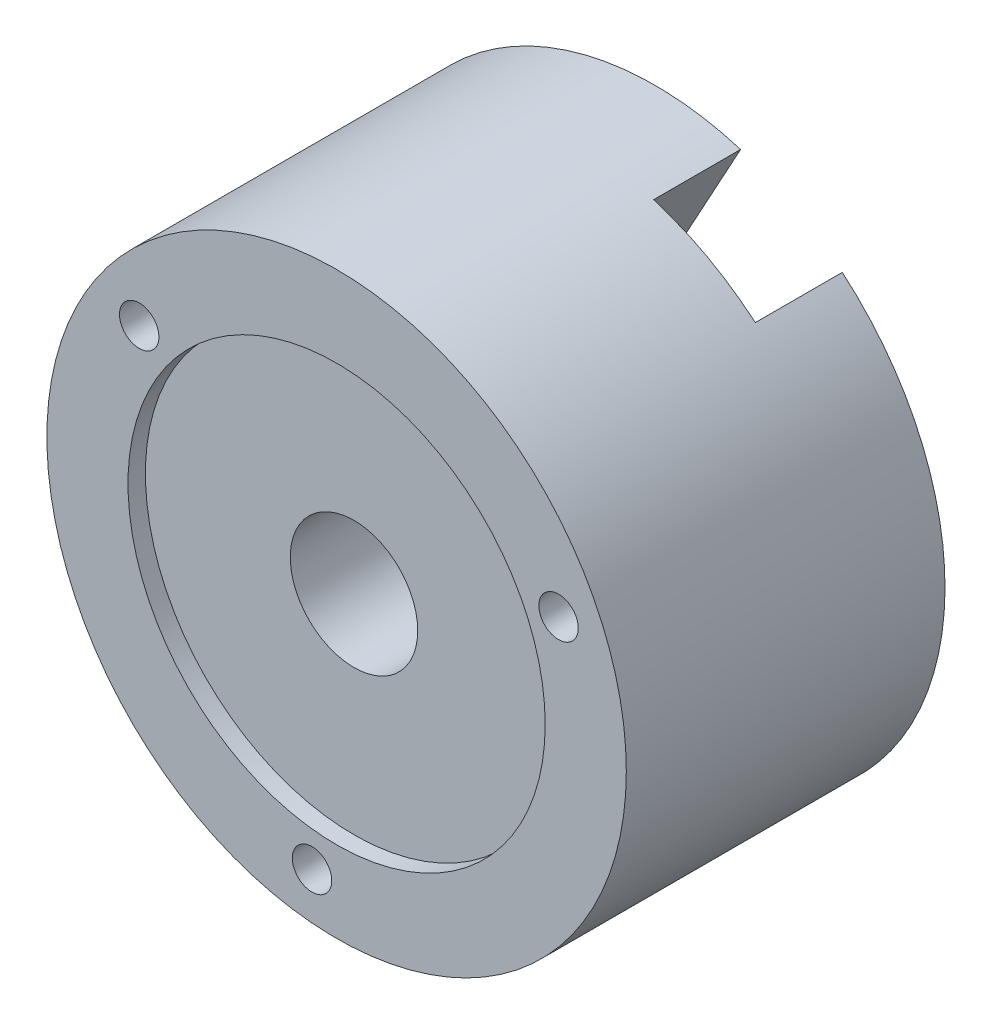
from build123d import *

# Parameters (mm, degrees)
SKETCH1_R                  = 50
BOSS_EXTRUDE1_DEPTH        = 55
SKETCH2_R                  = 36
CUT_EXTRUDE1_DEPTH         = 3
CUT_EXTRUDE2_REACH         = 89.772
SKETCH3_R                  = 11
M8X1_25_TAPPED_HOLE1_D     = 6.8
M8X1_25_TAPPED_HOLE1_DEPTH = 10.25
M8X1_25_TAPPED_HOLE1_TIP   = 2.042926105
CUT_EXTRUDE3_DEPTH         = 15


with BuildPart() as part:
    # Sketch1 → Boss-Extrude1 (new body)
    with BuildSketch(Plane.XY):
        Circle(SKETCH1_R)
    extrude(amount=BOSS_EXTRUDE1_DEPTH)

    # Sketch2 → Cut-Extrude1 (cut)
    with BuildSketch(Plane.XY.offset(55)):
        Circle(SKETCH2_R)
    extrude(amount=-CUT_EXTRUDE1_DEPTH, mode=Mode.SUBTRACT)

    # Sketch3 → Cut-Extrude2 (cut, up to next)
    with BuildSketch(Plane.XY.offset(52), mode=Mode.PRIVATE) as cut_extrude2_sk1:
        Circle(SKETCH3_R)
    cut_extrude2_tool1 = extrude(cut_extrude2_sk1.sketch, amount=-CUT_EXTRUDE2_REACH, mode=Mode.PRIVATE) & part.part
    add(cut_extrude2_tool1.solids().sort_by_distance((0, 0, 52))[0], mode=Mode.SUBTRACT)

    # M8x1.25 Tapped Hole1
    with Locations(Plane.XY.offset(55)):
        with Locations((-34.068677595, 24.562679147), (38.306242924, 17.223000697), (-4.237565329, -41.785679845), (0, 0)):
            Hole(M8X1_25_TAPPED_HOLE1_D / 2, depth=M8X1_25_TAPPED_HOLE1_DEPTH)
            with Locations((0, 0, -(M8X1_25_TAPPED_HOLE1_DEPTH + M8X1_25_TAPPED_HOLE1_TIP / 2))):  # 118° drill point
                Cone(0, M8X1_25_TAPPED_HOLE1_D / 2, M8X1_25_TAPPED_HOLE1_TIP, mode=Mode.SUBTRACT)

    # Sketch7 → Cut-Extrude3 (cut)
    with BuildSketch(Plane(origin=(0, 0, 0), x_dir=(-1, 0, 0), z_dir=(0, 0, -1))):
        Polygon((-56.730768418, 82.955529741), (-11.543830818, 0.270745983), (-60.557485259, -80.204681778), (-43.476211931, -90.608051497), (5.53744251, -10.132623736), (99.738034552, -12.341979735), (100.20698035, 7.652521756), (6.006388308, 9.861877754), (-39.180549293, 92.546661513), align=None)
    extrude(amount=-CUT_EXTRUDE3_DEPTH, mode=Mode.SUBTRACT)


solid = part.part
